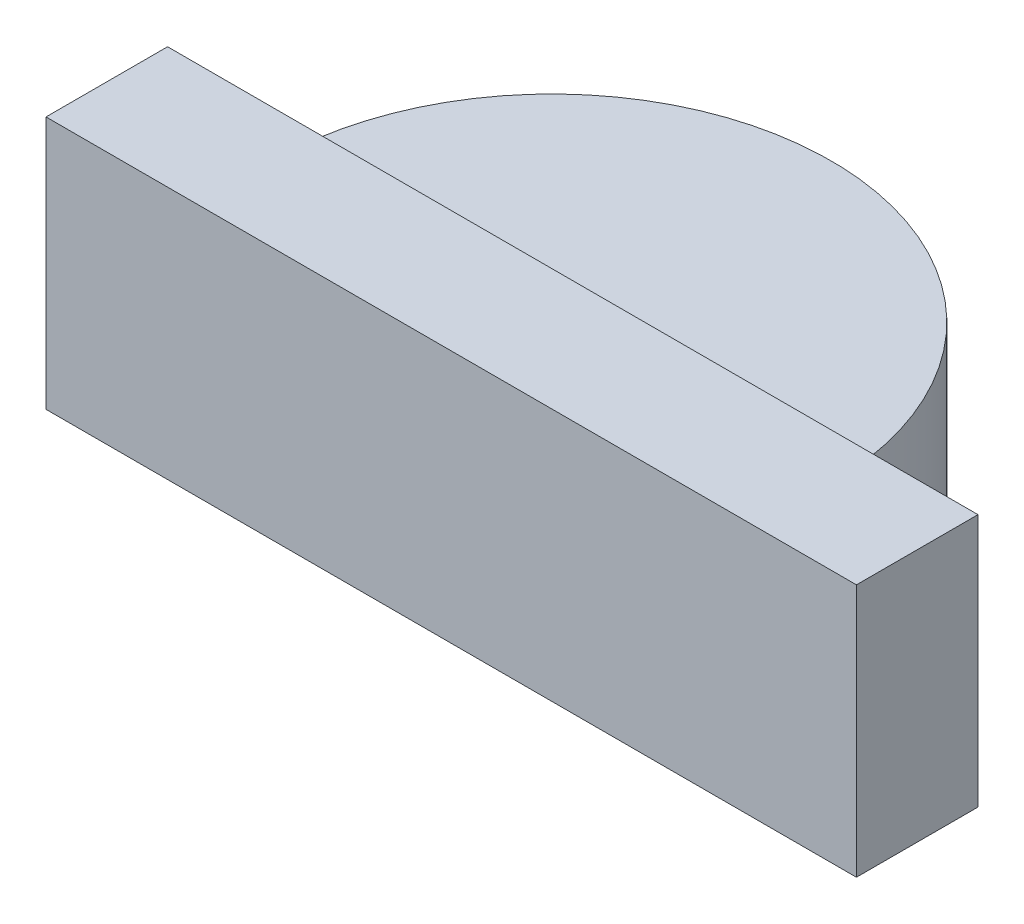
from build123d import *

# Parameters (mm, degrees)
SKETCH_1_W      = 3.2
SKETCH_1_H      = 1
EXTRUDE_1_DEPTH = 0.48
EXTRUDE_2_DEPTH = 0.4


with BuildPart() as part:
    # 草图1 → 凸台-拉伸1 (new body)
    with BuildSketch(Plane.XY):
        with Locations((1.6, 0.5)):
            Rectangle(SKETCH_1_W, SKETCH_1_H)
    extrude(amount=EXTRUDE_1_DEPTH)

    # 草图2 → 凸台-拉伸2 (add, symmetric)
    with BuildSketch(Plane(origin=(0, 0.5, 0), x_dir=(-1, 0, 0), z_dir=(0, -1, 0))):
        with BuildLine():
            Line((-0.5, 0), (-2.7, 0))
            ThreePointArc((-2.7, 0), (-1.6, 1.02), (-0.5, 0))
        make_face()
    extrude(amount=EXTRUDE_2_DEPTH, both=True)


solid = part.part
